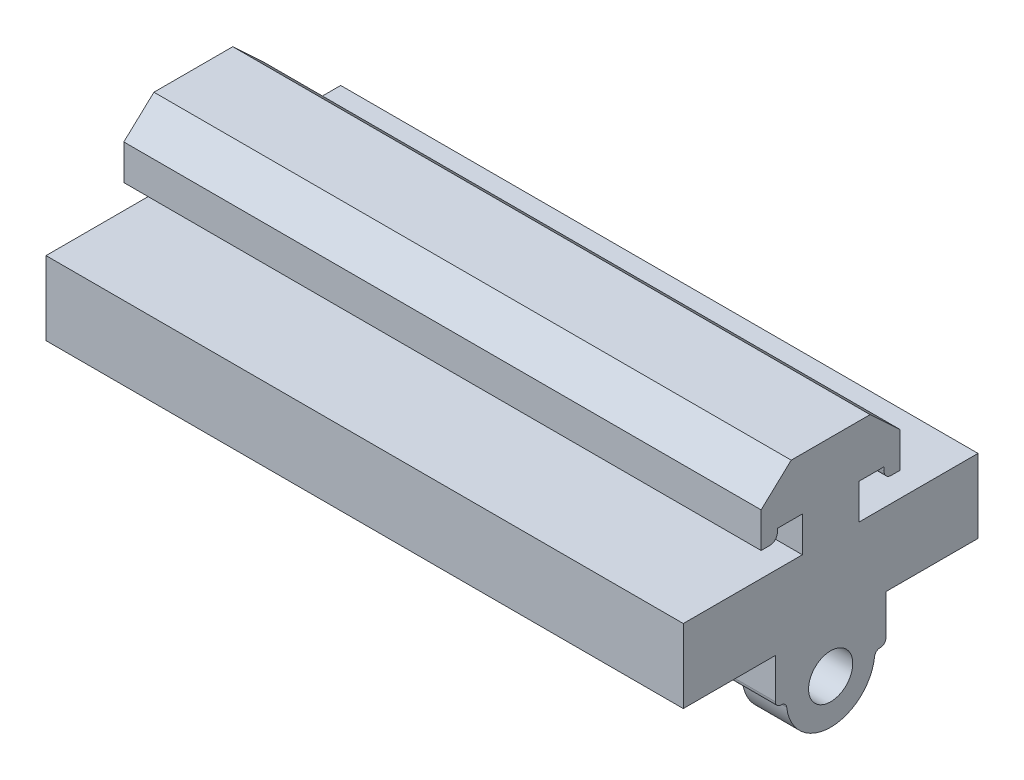
from build123d import *

# Parameters (mm, degrees)
SKETCH1_W           = 74.5
SKETCH1_H           = 40
BOSS_EXTRUDE1_DEPTH = 10
BOSS_EXTRUDE2_DEPTH = 6
BOSS_EXTRUDE3_DEPTH = 86.5


with BuildPart() as part:
    # Sketch1 → Boss-Extrude1 (new body)
    with BuildSketch(Plane(origin=(0, 0, 0), x_dir=(1, 0, 0), z_dir=(0, 1, 0))):
        Rectangle(SKETCH1_W, SKETCH1_H)
    extrude(amount=BOSS_EXTRUDE1_DEPTH)

    # Sketch2 → Boss-Extrude2 (add)
    # profile 1 of 2: a face of its own
    with BuildSketch(Plane(origin=(37.25, 0, 0), x_dir=(0, 0, -1), z_dir=(1, 0, 0))):
        with BuildLine():
            Line((7.5, 0), (-7.5, 0))
            Line((-7.5, 0), (-7.5, -5.45))
            ThreePointArc((-7.5, -5.45), (-7.280330086, -5.980330086), (-6.75, -6.2))
            Line((-6.75, -6.2), (-6.708203932, -6.2))
            ThreePointArc((-6.708203932, -6.2), (-6.208203932, -6.390983006), (-5.96284794, -6.866666667))
            ThreePointArc((-5.96284794, -6.866666667), (0, -12.2), (5.96284794, -6.866666667))
            ThreePointArc((5.96284794, -6.866666667), (6.208203932, -6.390983006), (6.708203932, -6.2))
            Line((6.708203932, -6.2), (6.75, -6.2))
            ThreePointArc((6.75, -6.2), (7.280330086, -5.980330086), (7.5, -5.45))
            Line((7.5, -5.45), (7.5, 0))
        make_face()
        with BuildLine():
            ThreePointArc((3, -6.2), (0, -9.2), (-3, -6.2))
            ThreePointArc((-3, -6.2), (0, -3.2), (3, -6.2))
        make_face(mode=Mode.SUBTRACT)
    # profile 2 of 2: a face of its own
    with BuildSketch(Plane(origin=(37.25, 0, 0), x_dir=(0, 0, -1), z_dir=(1, 0, 0))):
        Polygon((-20, 0), (-7.5, 0), (7.5, 0), (20, 0), (20, 10), (-20, 10), align=None)
    boss_extrude2 = extrude(amount=BOSS_EXTRUDE2_DEPTH)

    # Mirror1: Boss-Extrude2 across plane
    add(boss_extrude2.mirror(Plane(origin=(0, 0, 0), x_dir=(0, 0, 1), z_dir=(1, 0, 0))))

    # Sketch3 → Boss-Extrude3 (add)
    with BuildSketch(Plane.ZY.offset(43.25)):
        with BuildLine():
            Line((-3.838227356, 14.8), (-3.838227356, 10))
            Line((-3.838227356, 10), (3.838227356, 10))
            Line((3.838227356, 10), (3.838227356, 14.8))
            Line((3.838227356, 14.8), (7.238227356, 14.8))
            Line((7.238227356, 14.8), (7.238227356, 14.3))
            ThreePointArc((7.238227356, 14.3), (7.531120575, 13.592893219), (8.238227356, 13.3))
            Line((8.238227356, 13.3), (9.438227356, 13.3))
            Line((9.438227356, 13.3), (9.438227356, 14.8))
            Line((9.438227356, 14.8), (9.438227356, 18.08))
            Line((9.438227356, 18.08), (5.3521045, 21.88))
            Line((5.3521045, 21.88), (-5.3521045, 21.88))
            Line((-5.3521045, 21.88), (-9.438227356, 18.08))
            Line((-9.438227356, 18.08), (-9.438227356, 14.8))
            Line((-9.438227356, 14.8), (-9.438227356, 13.3))
            Line((-9.438227356, 13.3), (-8.238227356, 13.3))
            ThreePointArc((-8.238227356, 13.3), (-7.531120575, 13.592893219), (-7.238227356, 14.3))
            Line((-7.238227356, 14.3), (-7.238227356, 14.8))
            Line((-7.238227356, 14.8), (-3.838227356, 14.8))
        make_face()
    extrude(amount=-BOSS_EXTRUDE3_DEPTH)


solid = part.part
